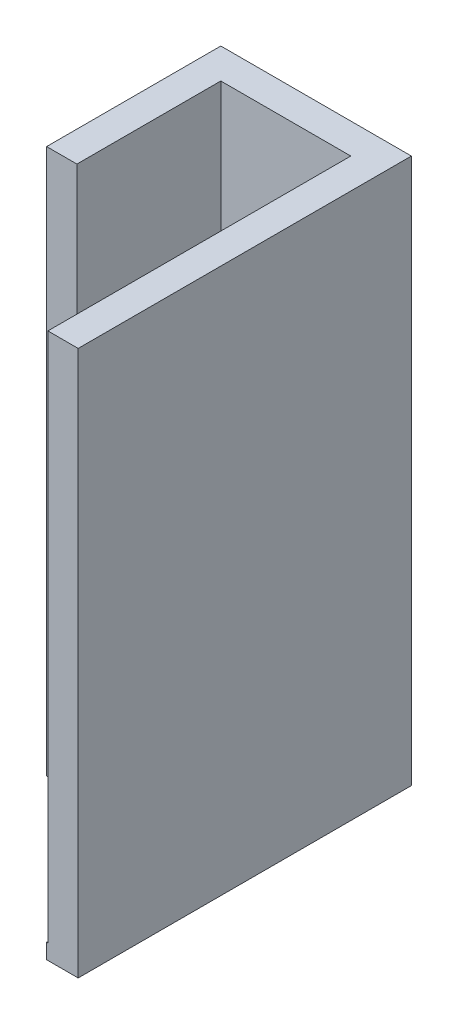
from build123d import *

# Parameters (mm, degrees)
BOSS_EXTRUDE1_DEPTH = 5486.4
EXTRUDE_THIN1_DEPTH = 152.4


with BuildPart() as part:
    # Sketch1 → Boss-Extrude1 (new body)
    with BuildSketch(Plane(origin=(0, 0, 0), x_dir=(1, 0, 0), z_dir=(0, 1, 0))):
        Polygon((-304.8, 0), (-304.8, 1752.6), (1612.9, 1752.6), (1612.9, -1600.2), (1308.1, -1600.2), (1308.1, 1447.8), (0, 1447.8), (0, 0), align=None)
    extrude(amount=BOSS_EXTRUDE1_DEPTH)

    # Sketch2 → Extrude-Thin1 (add)
    with BuildSketch(Plane(origin=(0, 0, 0), x_dir=(1, 0, 0), z_dir=(0, 1, 0))):
        Polygon((0, 0), (12.7, 0), (12.7, 1435.1), (1295.4, 1435.1), (1295.4, -1600.2), (1308.1, -1600.2), (1308.1, -1597.66), (1297.94, -1597.66), (1297.94, 1437.64), (10.16, 1437.64), (10.16, 2.54), (0, 2.54), align=None)
    extrude(amount=EXTRUDE_THIN1_DEPTH)


solid = part.part
